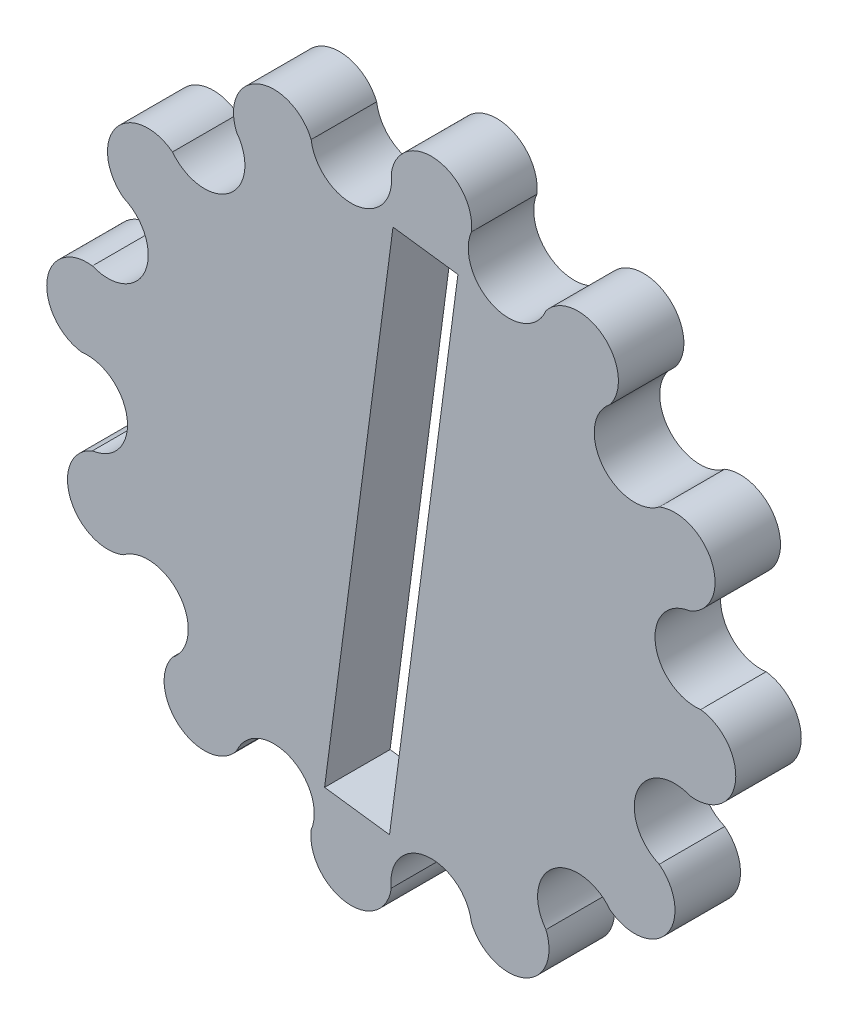
from build123d import *

# Parameters (mm, degrees)
BOSS_EXTRUDE1_DEPTH = 3.175
CUT_EXTRUDE1_DEPTH  = 3.175


with BuildPart() as part:
    # Sketch1 → Boss-Extrude1 (new body)
    with BuildSketch(Plane.XY):
        with BuildLine():
            ThreePointArc((-3.882285677, 14.488887394), (-1.685586535, 12.803300859), (0, 15))
            ThreePointArc((0, 15), (2.196699141, 16.685586535), (3.882285677, 14.488887394))
            ThreePointArc((3.882285677, 14.488887394), (4.941889669, 11.930777064), (7.5, 12.990381057))
            ThreePointArc((7.5, 12.990381057), (10.245190528, 13.351792246), (10.606601718, 10.606601718))
            ThreePointArc((10.606601718, 10.606601718), (10.245190528, 7.861411189), (12.990381057, 7.5))
            ThreePointArc((12.990381057, 7.5), (15.548491387, 6.440396007), (14.488887394, 3.882285677))
            ThreePointArc((14.488887394, 3.882285677), (12.803300859, 1.685586535), (15, 0))
            ThreePointArc((15, 0), (16.685586535, -2.196699141), (14.488887394, -3.882285677))
            ThreePointArc((14.488887394, -3.882285677), (11.930777064, -4.941889669), (12.990381057, -7.5))
            ThreePointArc((12.990381057, -7.5), (13.351792246, -10.245190528), (10.606601718, -10.606601718))
            ThreePointArc((10.606601718, -10.606601718), (7.861411189, -10.245190528), (7.5, -12.990381057))
            ThreePointArc((7.5, -12.990381057), (6.440396007, -15.548491387), (3.882285677, -14.488887394))
            ThreePointArc((3.882285677, -14.488887394), (1.685586535, -12.803300859), (0, -15))
            ThreePointArc((0, -15), (-2.196699141, -16.685586535), (-3.882285677, -14.488887394))
            ThreePointArc((-3.882285677, -14.488887394), (-4.941889669, -11.930777064), (-7.5, -12.990381057))
            ThreePointArc((-7.5, -12.990381057), (-10.245190528, -13.351792246), (-10.606601718, -10.606601718))
            ThreePointArc((-10.606601718, -10.606601718), (-10.245190528, -7.861411189), (-12.990381057, -7.5))
            ThreePointArc((-12.990381057, -7.5), (-15.548491387, -6.440396007), (-14.488887394, -3.882285677))
            ThreePointArc((-14.488887394, -3.882285677), (-12.803300859, -1.685586535), (-15, 0))
            ThreePointArc((-15, 0), (-16.685586535, 2.196699141), (-14.488887394, 3.882285677))
            ThreePointArc((-14.488887394, 3.882285677), (-11.930777064, 4.941889669), (-12.990381057, 7.5))
            ThreePointArc((-12.990381057, 7.5), (-13.351792246, 10.245190528), (-10.606601718, 10.606601718))
            ThreePointArc((-10.606601718, 10.606601718), (-7.861411189, 10.245190528), (-7.5, 12.990381057))
            ThreePointArc((-7.5, 12.990381057), (-6.440396007, 15.548491387), (-3.882285677, 14.488887394))
        make_face()
    extrude(amount=BOSS_EXTRUDE1_DEPTH)

    # Sketch3 → Cut-Extrude1 (cut)
    with BuildSketch(Plane.XY):
        Polygon((3.231601359, 12.384139409), (0.083763924, 12.79856007), (-3.231601359, -12.384139409), (-0.083763924, -12.79856007), align=None)
    extrude(amount=CUT_EXTRUDE1_DEPTH, mode=Mode.SUBTRACT)


solid = part.part
